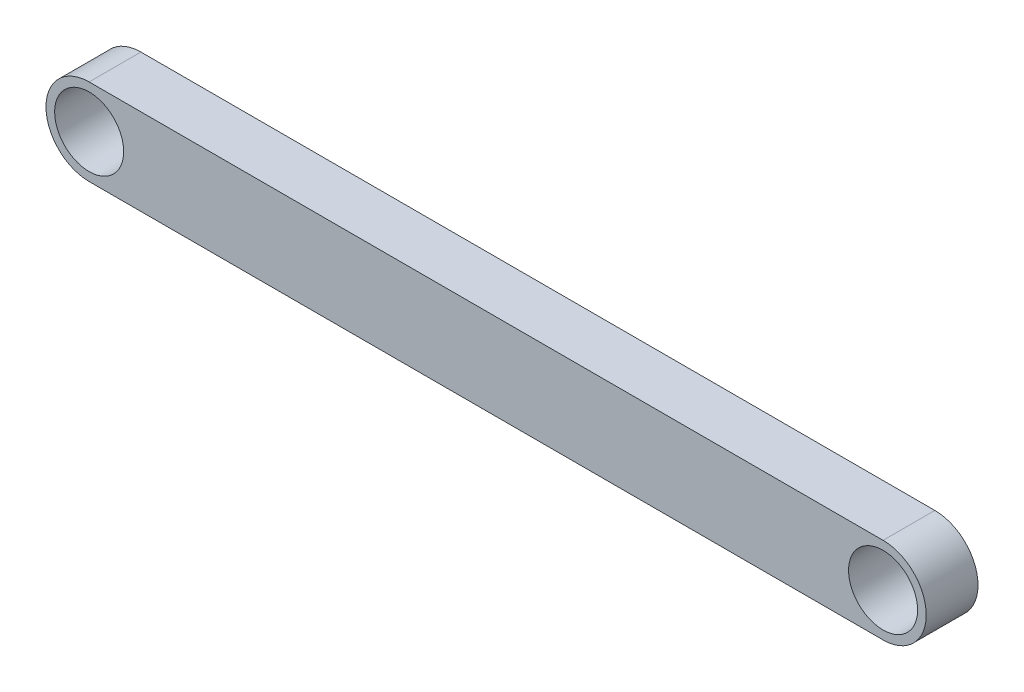
from build123d import *

# Parameters (mm, degrees)
SKETCH_1_R      = 2
EXTRUDE_1_DEPTH = 3


with BuildPart() as part:
    # 草图1 → 凸台-拉伸1 (new body)
    with BuildSketch(Plane.XY):
        with BuildLine():
            Line((0, 2.5), (-46, 2.5))
            ThreePointArc((-46, 2.5), (-48.5, 0), (-46, -2.5))
            Line((-46, -2.5), (0, -2.5))
            ThreePointArc((0, -2.5), (2.5, 0), (0, 2.5))
        make_face()
        Circle(SKETCH_1_R, mode=Mode.SUBTRACT)
        with Locations(Location((-46, 0, 0), (0, 0, 180))):
            Circle(SKETCH_1_R, mode=Mode.SUBTRACT)
    extrude(amount=EXTRUDE_1_DEPTH)


solid = part.part
